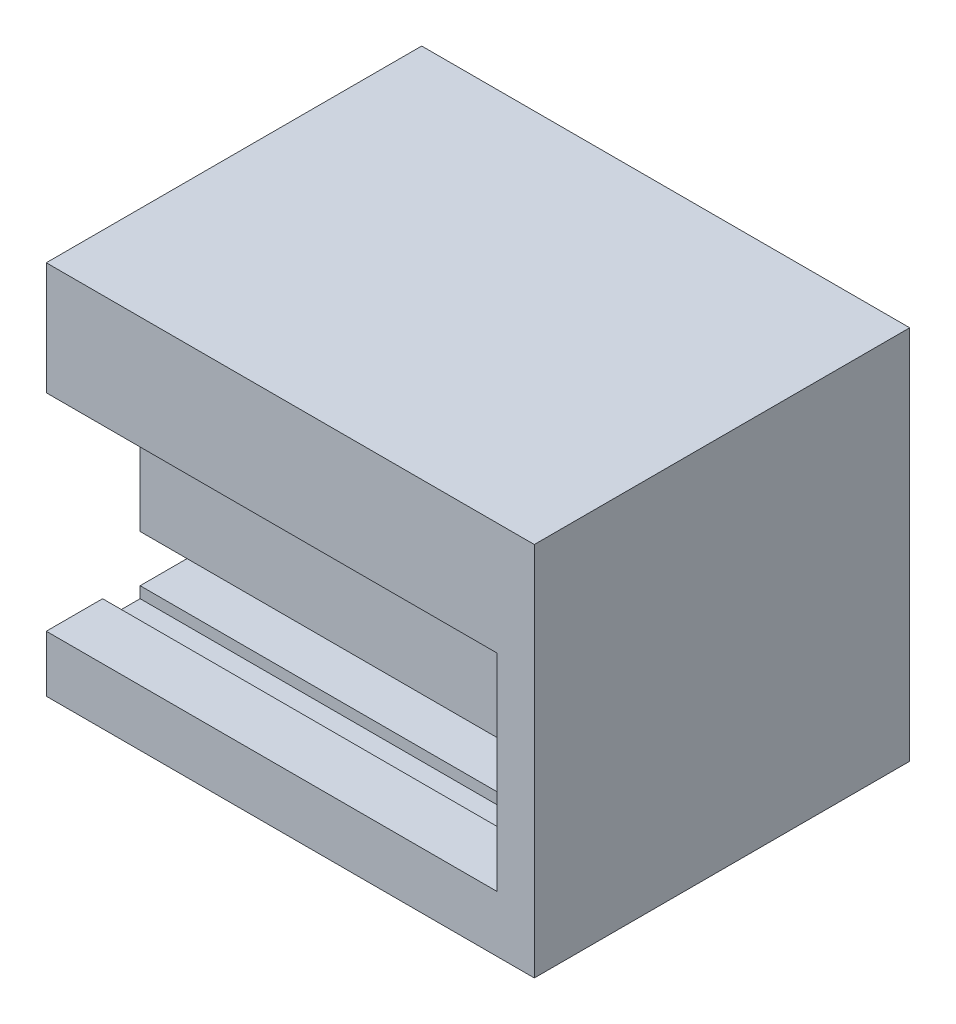
from build123d import *

# Parameters (mm, degrees)
SKETCH1_W           = 33.02
SKETCH1_H           = 25.4
BOSS_EXTRUDE1_DEPTH = 25.4
CUT_EXTRUDE2_START  = -3.81
SKETCH1_4_W         = 27.94
SKETCH1_4_H         = 5.08
SKETCH1_4_H_2       = 1.27
CUT_EXTRUDE2_DEPTH  = 2.54
SKETCH1_3_W         = 27.94
SKETCH1_3_H         = 13.97
CUT_EXTRUDE1_DEPTH  = 6.35
CUT_EXTRUDE3_START  = -6.35
SKETCH1_5_W         = 15.875
SKETCH1_5_H         = 3.175
CUT_EXTRUDE3_DEPTH  = 19.05
SKETCH4_W           = 12.7
SKETCH4_H           = 3.175
CUT_EXTRUDE4_DEPTH  = 19.05
CUT_EXTRUDE5_DEPTH  = 6.35


with BuildPart() as part:
    # Sketch1 → Boss-Extrude1 (new body)
    with BuildSketch(Plane.XY):
        with Locations((-2.974473684, 2.395175439)):
            Rectangle(SKETCH1_W, SKETCH1_H)
    extrude(amount=-BOSS_EXTRUDE1_DEPTH)

    # Sketch1<4> → Cut-Extrude2 (cut)
    with BuildSketch(Plane.XY.offset(CUT_EXTRUDE2_START)):
        with Locations((-2.974473684, 10.015175439)):
            Rectangle(SKETCH1_4_W, SKETCH1_4_H)
        with Locations((-2.974473684, -7.129824561)):
            Rectangle(SKETCH1_4_W, SKETCH1_4_H_2)
    extrude(amount=-CUT_EXTRUDE2_DEPTH, mode=Mode.SUBTRACT)

    # Sketch1<3> → Cut-Extrude1 (cut)
    with BuildSketch(Plane.XY):
        with Locations((-2.974473684, 0.490175439)):
            Rectangle(SKETCH1_3_W, SKETCH1_3_H)
    extrude(amount=-CUT_EXTRUDE1_DEPTH, mode=Mode.SUBTRACT)

    # Sketch1<5> → Cut-Extrude3 (cut)
    with BuildSketch(Plane.XY.offset(CUT_EXTRUDE3_START)):
        with Locations((-2.974473684, -5.415324561)):
            Rectangle(SKETCH1_5_W, SKETCH1_5_H)
    extrude(amount=-CUT_EXTRUDE3_DEPTH, mode=Mode.SUBTRACT)

    # Sketch4 → Cut-Extrude4 (cut)
    with BuildSketch(Plane(origin=(-10.911973684, 0, 0), x_dir=(0, 0, -1), z_dir=(1, 0, 0))):
        with Locations((12.7, -5.415324561)):
            Rectangle(SKETCH4_W, SKETCH4_H)
    extrude(amount=-CUT_EXTRUDE4_DEPTH, mode=Mode.SUBTRACT)

    # Sketch7 → Cut-Extrude5 (cut)
    with BuildSketch(Plane(origin=(-16.944473684, 0, 0), x_dir=(0, 0, -1), z_dir=(1, 0, 0))):
        Polygon((0, 7.475175439), (3.81, 7.475175439), (3.81, 12.555175439), (6.35, 12.555175439), (6.35, -7.764824561), (3.81, -7.764824561), (3.81, -6.494824561), (0, -6.494824561), align=None)
    extrude(amount=-CUT_EXTRUDE5_DEPTH, mode=Mode.SUBTRACT)


solid = part.part
